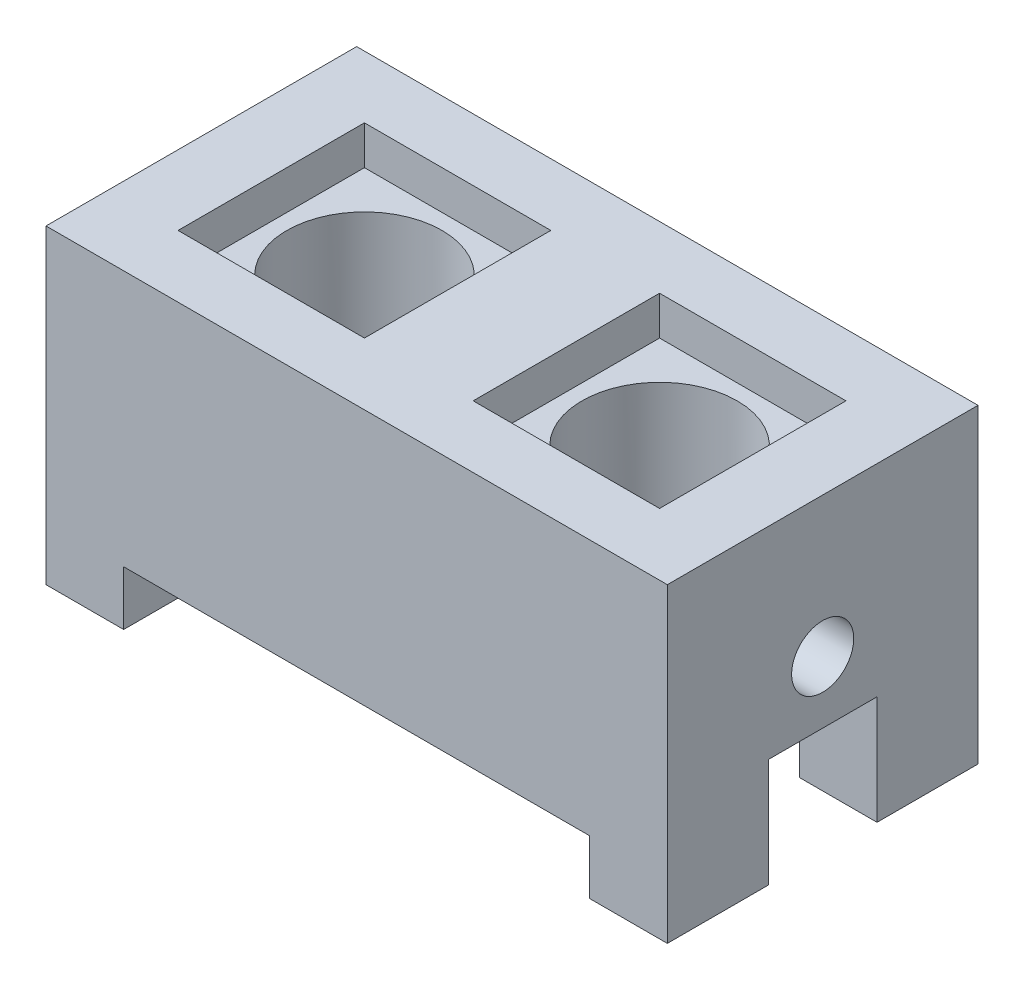
from build123d import *

# Parameters (mm, degrees)
SKETCH1_W               = 80
SKETCH1_H               = 40
BOSS_EXTRUDE1_DEPTH     = 20
SKETCH2_W               = 60
SKETCH2_H               = 7
CUT_EXTRUDE1_DEPTH      = 40
SKETCH3_W               = 14
SKETCH3_H               = 14
CUT_EXTRUDE2_DEPTH      = 80
CUT_EXTRUDE3_DEPTH      = 92.651513899
CUT_EXTRUDE3_DEPTH_BACK = 80
SKETCH4_R               = 4
SKETCH5_W               = 24
SKETCH5_H               = 24
CUT_EXTRUDE4_DEPTH      = 5
SKETCH6_R               = 10
CUT_EXTRUDE6_DEPTH      = 92.651513899


with BuildPart() as part:
    # Sketch1 → Boss-Extrude1 (new, symmetric)
    with BuildSketch(Plane.XY):
        with Locations((40, 20)):
            Rectangle(SKETCH1_W, SKETCH1_H)
    extrude(amount=BOSS_EXTRUDE1_DEPTH, both=True)

    # Sketch2 → Cut-Extrude1 (cut)
    with BuildSketch(Plane.XY.offset(20)):
        with Locations((40, 3.5)):
            Rectangle(SKETCH2_W, SKETCH2_H)
    extrude(amount=-CUT_EXTRUDE1_DEPTH, mode=Mode.SUBTRACT)

    # Sketch3 → Cut-Extrude2 (cut)
    with BuildSketch(Plane(origin=(80, 0, 0), x_dir=(0, 0, -1), z_dir=(1, 0, 0))):
        with Locations((0, 7)):
            Rectangle(SKETCH3_W, SKETCH3_H)
    extrude(amount=-CUT_EXTRUDE2_DEPTH, mode=Mode.SUBTRACT)

    # Sketch4 → Cut-Extrude3 (cut, two sides: drawn at the far end of the back side and taken through both)
    with BuildSketch(Plane(origin=(80, 0, 0), x_dir=(0, 0, -1), z_dir=(1, 0, 0)).offset(-CUT_EXTRUDE3_DEPTH_BACK)):
        with Locations(Location((0, 22, 0), (0, 0, 180))):
            Circle(SKETCH4_R)
    extrude(amount=CUT_EXTRUDE3_DEPTH + CUT_EXTRUDE3_DEPTH_BACK, mode=Mode.SUBTRACT)

    # Sketch5 → Cut-Extrude4 (cut)
    with BuildSketch(Plane(origin=(0, 40, 0), x_dir=(1, 0, 0), z_dir=(0, 1, 0))):
        with Locations((59, 0)):
            Rectangle(SKETCH5_W, SKETCH5_H)
        with Locations((21, 0)):
            Rectangle(SKETCH5_W, SKETCH5_H)
    extrude(amount=-CUT_EXTRUDE4_DEPTH, mode=Mode.SUBTRACT)

    # Sketch6 → Cut-Extrude6 (cut, through all)
    with BuildSketch(Plane(origin=(0, 40, 0), x_dir=(1, 0, 0), z_dir=(0, 1, 0))):
        with Locations(Location((59, 0, 0), (0, 0, 224.427004001))):
            Circle(SKETCH6_R)
        with Locations(Location((21, 0, 0), (0, 0, 224.427004001))):
            Circle(SKETCH6_R)
    extrude(amount=-CUT_EXTRUDE6_DEPTH, mode=Mode.SUBTRACT)


solid = part.part
